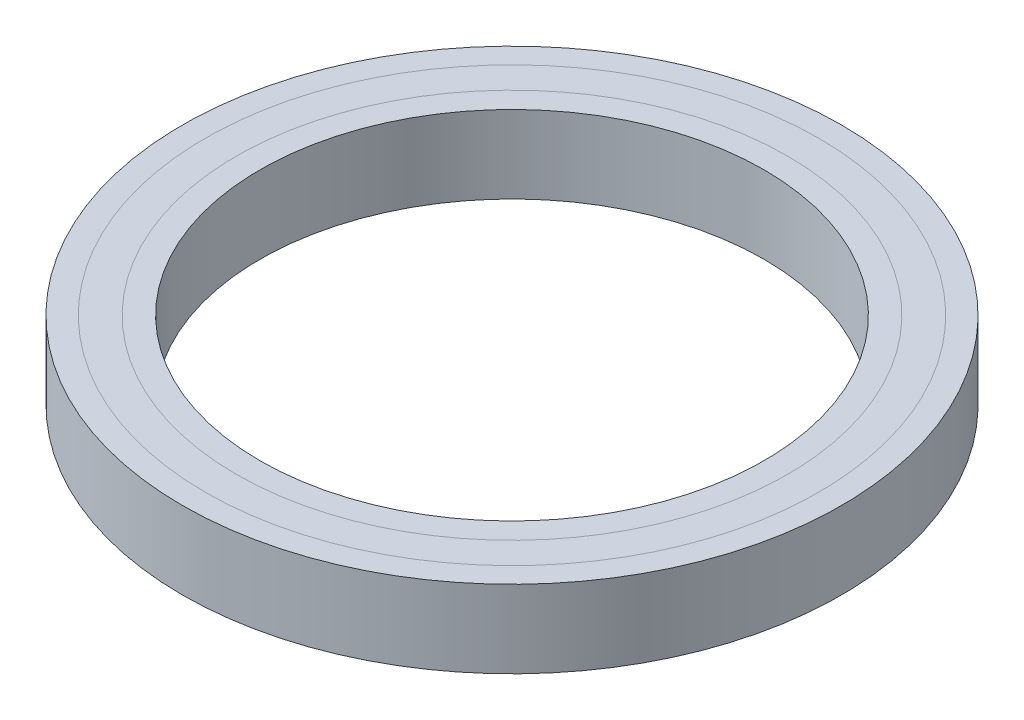
from build123d import *

# Parameters (mm, degrees)
SKETCH1_R           = 35.55
SKETCH1_R_2         = 32.5
BOSS_EXTRUDE1_DEPTH = 10
SKETCH2_R           = 39.55
SKETCH2_R_2         = 35.55
BOSS_EXTRUDE2_DEPTH = 10
SKETCH3_R           = 42.5
SKETCH3_R_2         = 39.55
BOSS_EXTRUDE4_DEPTH = 10


with BuildPart() as part:
    # Sketch1 → Boss-Extrude1 (new body)
    with BuildSketch(Plane(origin=(0, 0, 0), x_dir=(1, 0, 0), z_dir=(0, 1, 0))):
        with Locations(Location((0, 0, 0), (0, 0, 270))):
            Circle(SKETCH1_R)
        with Locations(Location((0, 0, 0), (0, 0, 270))):
            Circle(SKETCH1_R_2, mode=Mode.SUBTRACT)
    extrude(amount=BOSS_EXTRUDE1_DEPTH)


with BuildPart() as body_2:
    # Sketch2 → Boss-Extrude2 (new body)
    with BuildSketch(Plane(origin=(0, 0, 0), x_dir=(1, 0, 0), z_dir=(0, 1, 0))):
        with Locations(Location((0, 0, 0), (0, 0, 270))):
            Circle(SKETCH2_R)
        with Locations(Location((0, 0, 0), (0, 0, 270))):
            Circle(SKETCH2_R_2, mode=Mode.SUBTRACT)
    extrude(amount=BOSS_EXTRUDE2_DEPTH)


with BuildPart() as body_3:
    # Sketch3 → Boss-Extrude4 (new body)
    with BuildSketch(Plane(origin=(0, 0, 0), x_dir=(1, 0, 0), z_dir=(0, 1, 0))):
        with Locations(Location((0, 0, 0), (0, 0, 270))):
            Circle(SKETCH3_R)
        with Locations(Location((0, 0, 0), (0, 0, 270))):
            Circle(SKETCH3_R_2, mode=Mode.SUBTRACT)
    extrude(amount=BOSS_EXTRUDE4_DEPTH)


solid = Compound([part.part, body_2.part, body_3.part])
